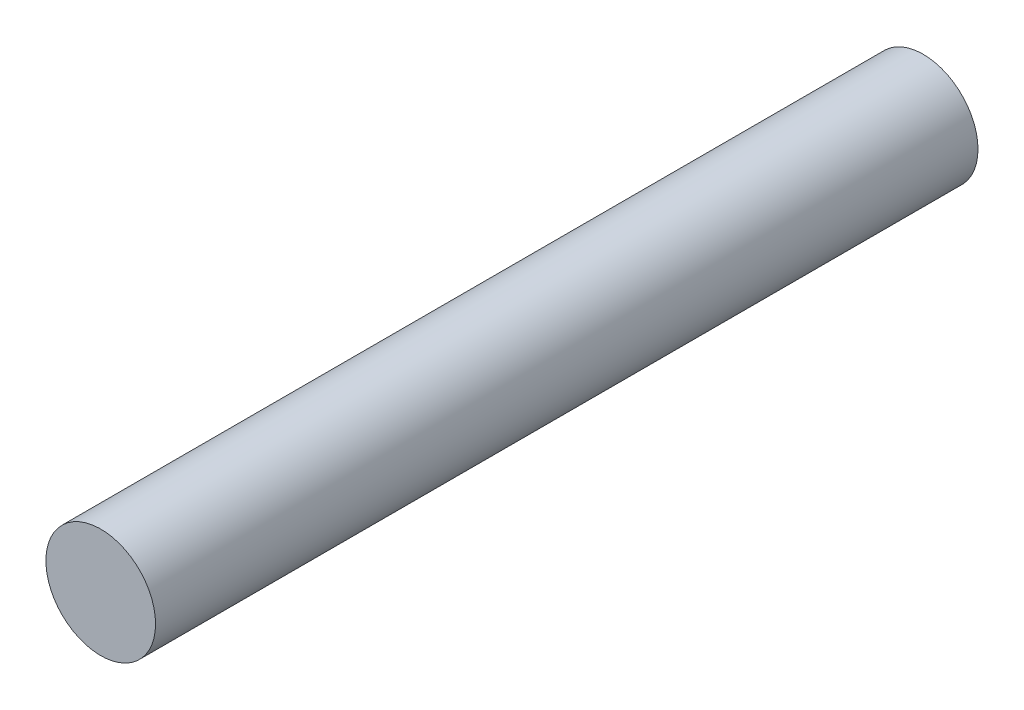
from build123d import *

# Parameters (mm, degrees)
SKIZZE1_R                       = 10
AUFSATZ_LINEAR_AUSTRAGEN1_DEPTH = 150


with BuildPart() as part:
    # Skizze1 → Aufsatz-Linear austragen1 (new body)
    with BuildSketch(Plane.XY):
        Circle(SKIZZE1_R)
    extrude(amount=AUFSATZ_LINEAR_AUSTRAGEN1_DEPTH)


solid = part.part
